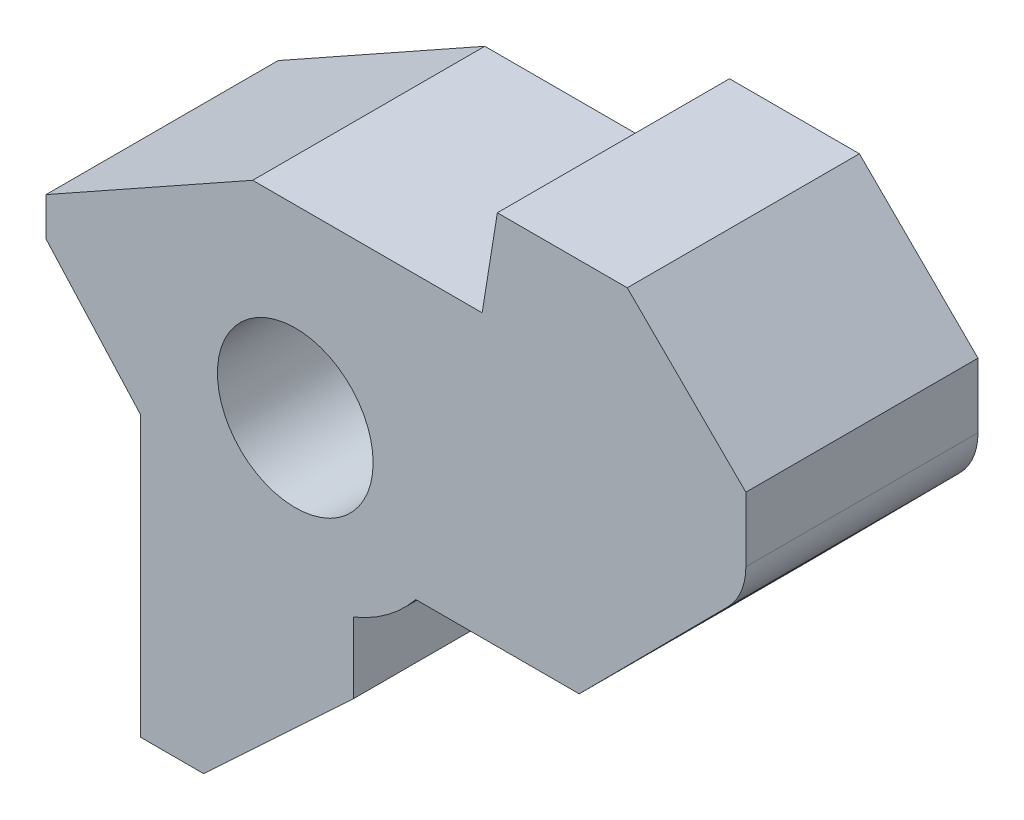
from build123d import *

# Parameters (mm, degrees)
SKETCH_1_R      = 2.515
EXTRUDE_1_DEPTH = 7.5
FILLET_1_R      = 2


with BuildPart() as part:
    # 스케치1 → 보스-돌출1 (new body)
    with BuildSketch(Plane.XY):
        with BuildLine():
            Line((-8.053143001, 0.978578295), (-5, -2.40902013))
            Line((-5, -2.40902013), (-5, -11.436332264))
            Line((-5, -11.436332264), (-2.956819065, -11.436332264))
            Line((-2.956819065, -11.436332264), (1.87605446, -6.923867857))
            Line((1.87605446, -6.923867857), (1.87605446, -4.634697365))
            ThreePointArc((1.87605446, -4.634697365), (2.980195691, -4.014776911), (3.893195608, -3.13736003))
            Line((3.893195608, -3.13736003), (9.172978659, -3.13736003))
            Line((9.172978659, -3.13736003), (14.557074242, 2.286312605))
            Line((14.557074242, 2.286312605), (14.557074242, 5.198022376))
            Line((14.557074242, 5.198022376), (10.725649804, 9.001488547))
            Line((10.725649804, 9.001488547), (6.528593017, 9.001488547))
            Line((6.528593017, 9.001488547), (6.037882178, 5.957406269))
            Line((6.037882178, 5.957406269), (-1.376355668, 5.957406269))
            Line((-1.376355668, 5.957406269), (-8.053143001, 2.219229384))
            Line((-8.053143001, 2.219229384), (-8.053143001, 0.978578295))
        make_face()
        Circle(SKETCH_1_R, mode=Mode.SUBTRACT)
    extrude(amount=EXTRUDE_1_DEPTH)

    # 필렛1
    fillet_1_edges = [part.edges().sort_by_distance(p)[0] for p in [
        (14.557074242, 2.286312605, 3.75),
    ]]
    fillet(fillet_1_edges, radius=FILLET_1_R)


solid = part.part
